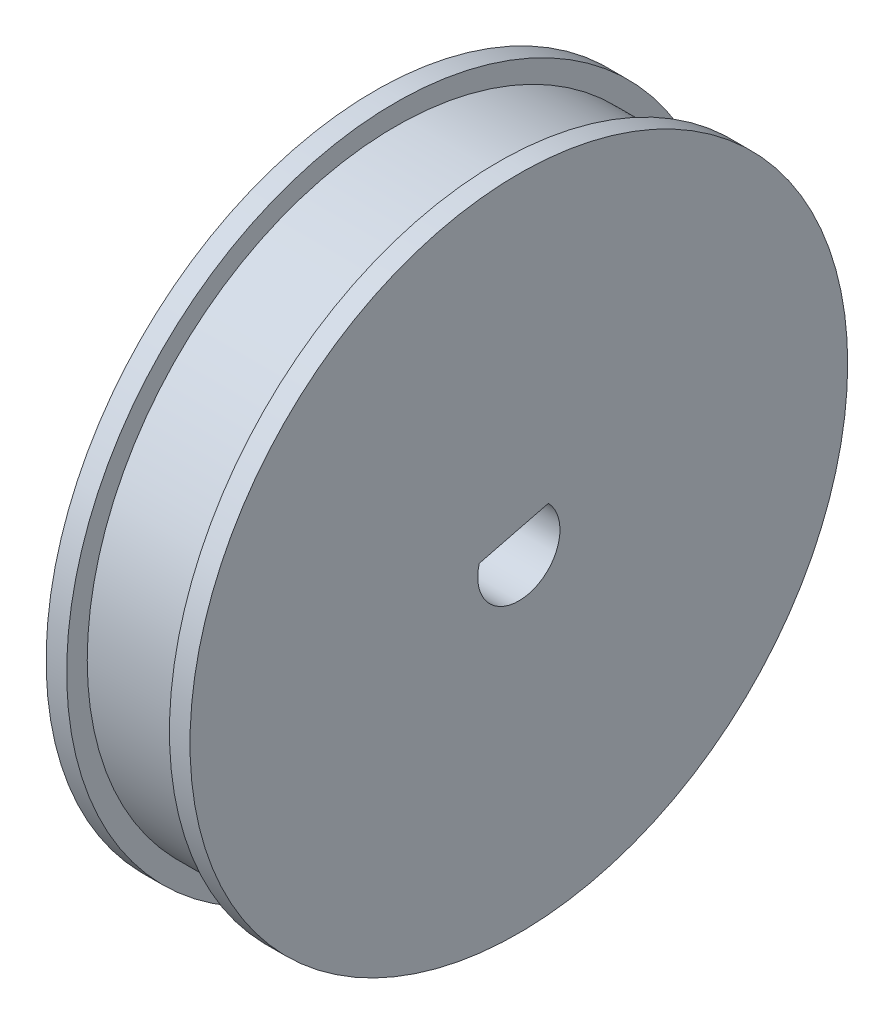
from build123d import *

# Parameters (mm, degrees)
SKETCH1_R           = 16
BOSS_EXTRUDE1_DEPTH = 7
CUT_EXTRUDE1_START  = -5
SKETCH3_R           = 16
SKETCH3_R_2         = 15
CUT_EXTRUDE1_DEPTH  = 5


with BuildPart() as part:
    # Sketch1 → Boss-Extrude1 (new body)
    with BuildSketch(Plane(origin=(0, 0, 0), x_dir=(0, 0, -1), z_dir=(1, 0, 0))):
        Circle(SKETCH1_R)
        with BuildLine():
            Line((-1.923932435, 0.546336878), (1.435107833, 1.393005925))
            ThreePointArc((1.435107833, 1.393005925), (0.488824602, -1.939342803), (-1.923932435, 0.546336878))
        make_face(mode=Mode.SUBTRACT)
    extrude(amount=BOSS_EXTRUDE1_DEPTH)

    # Sketch3 → Cut-Extrude1 (cut)
    with BuildSketch(Plane(origin=(6, 0, 0), x_dir=(0, 0, -1), z_dir=(1, 0, 0)).offset(CUT_EXTRUDE1_START)):
        Circle(SKETCH3_R)
        Circle(SKETCH3_R_2, mode=Mode.SUBTRACT)
    extrude(amount=CUT_EXTRUDE1_DEPTH, mode=Mode.SUBTRACT)


solid = part.part
